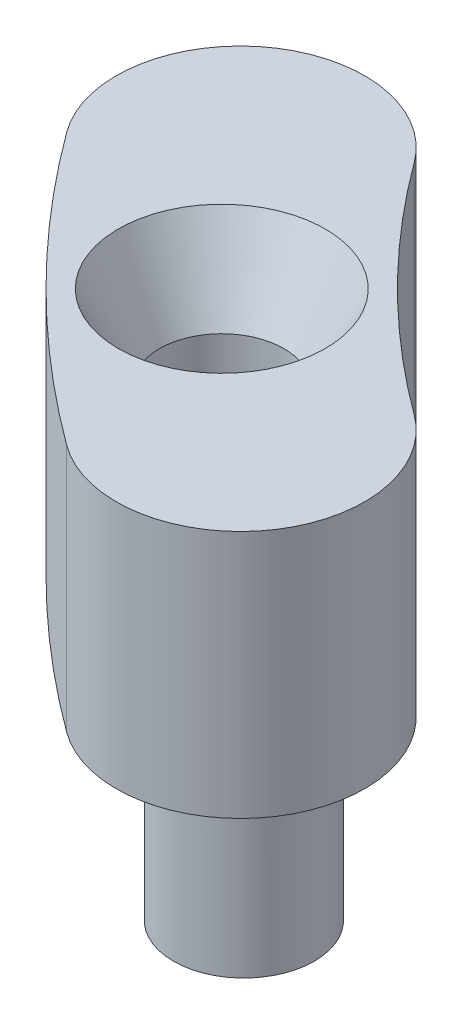
from build123d import *

# Parameters (mm, degrees)
SKETCH_1_R      = 1.5
EXTRUDE_1_DEPTH = 6
SKETCH_3_R      = 1.7
SKETCH_3_R_2    = 2
EXTRUDE_2_DEPTH = 4


with BuildPart() as part:
    # 草图1 → 凸台-拉伸1 (new body)
    with BuildSketch(Plane(origin=(0, 0, 0), x_dir=(1, 0, 0), z_dir=(0, 1, 0))):
        with BuildLine():
            ThreePointArc((-24.592495152, -18.040487305), (-21.566756826, -21.566756826), (-18.040487305, -24.592495152))
            ThreePointArc((-18.040487305, -24.592495152), (-13.847079195, -23.948035364), (-14.491538983, -19.754627253))
            ThreePointArc((-14.491538983, -19.754627253), (-17.324116139, -17.324116139), (-19.754627253, -14.491538983))
            ThreePointArc((-19.754627253, -14.491538983), (-23.948035364, -13.847079195), (-24.592495152, -18.040487305))
        make_face()
        with Locations((-19.445436483, -19.445436483)):
            Circle(SKETCH_1_R, mode=Mode.SUBTRACT)
    extrude(amount=EXTRUDE_1_DEPTH)

    # 草图2 → 切除-旋转1 (revolve, cut)
    with BuildSketch(Plane(origin=(-19.445436483, 0, 0), x_dir=(0, 0, -1), z_dir=(1, 0, 0))):
        Polygon((-19.445436483, 6), (-21.945436483, 6), (-20.695436483, 3.5), (-19.445436483, 3.5), align=None)
    revolve(axis=Axis((-19.445436483, 6, 19.445436483), (0, -1, 0)), mode=Mode.SUBTRACT)

    # 草图3 → 凸台-拉伸2 (add)
    with BuildSketch(Plane.XZ):
        with Locations((-15.969331282, 22.388176755)):
            Circle(SKETCH_3_R)
        with Locations((-22.388176755, 15.969331282)):
            Circle(SKETCH_3_R_2)
    extrude(amount=EXTRUDE_2_DEPTH)


solid = part.part
